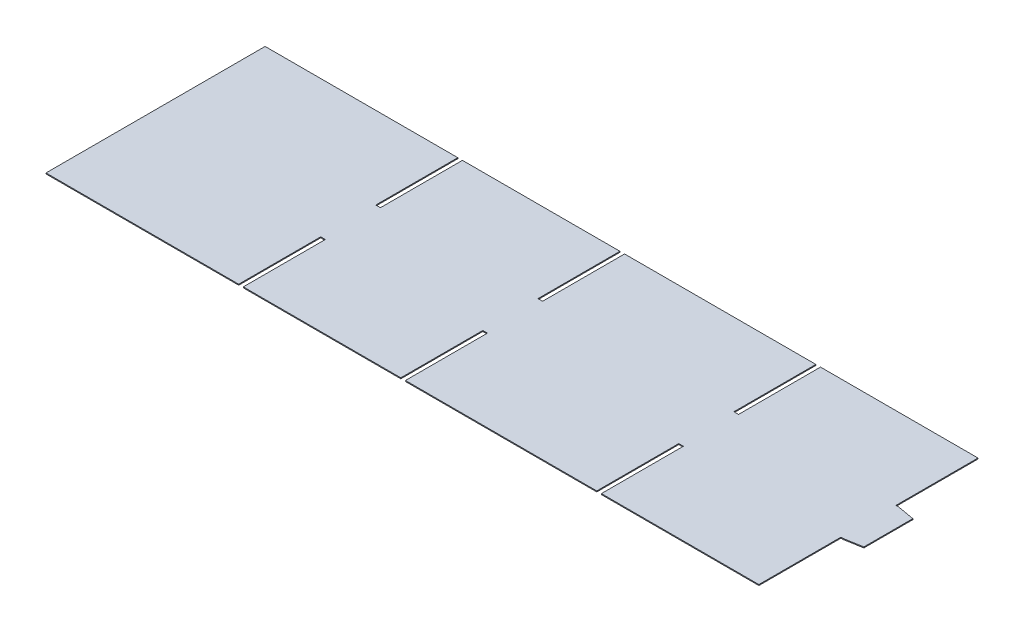
from build123d import *

# Parameters (mm, degrees)
BOSS_EXTRUDE1_DEPTH = 2


with BuildPart() as part:
    # Sketch1 → Boss-Extrude1 (new body)
    with BuildSketch(Plane(origin=(0, 0, 0), x_dir=(1, 0, 0), z_dir=(0, 1, 0))):
        Polygon((0, 0), (0, 296), (416, 296), (416, 119), (426, 119), (426, 296), (766, 296), (766, 119), (776, 119), (776, 296), (1189, 296), (1189, 119), (1199, 119), (1199, 296), (1539, 296), (1539, 119), (1544, 119), (1582, 112.299574733), (1582, 6.700425267), (1544, 0), (1539, 0), (1539, -177), (1199, -177), (1199, 0), (1189, 0), (1189, -177), (776, -177), (776, 0), (766, 0), (766, -177), (426, -177), (426, 0), (416, 0), (416, -177), (0, -177), align=None)
    extrude(amount=BOSS_EXTRUDE1_DEPTH)


solid = part.part
